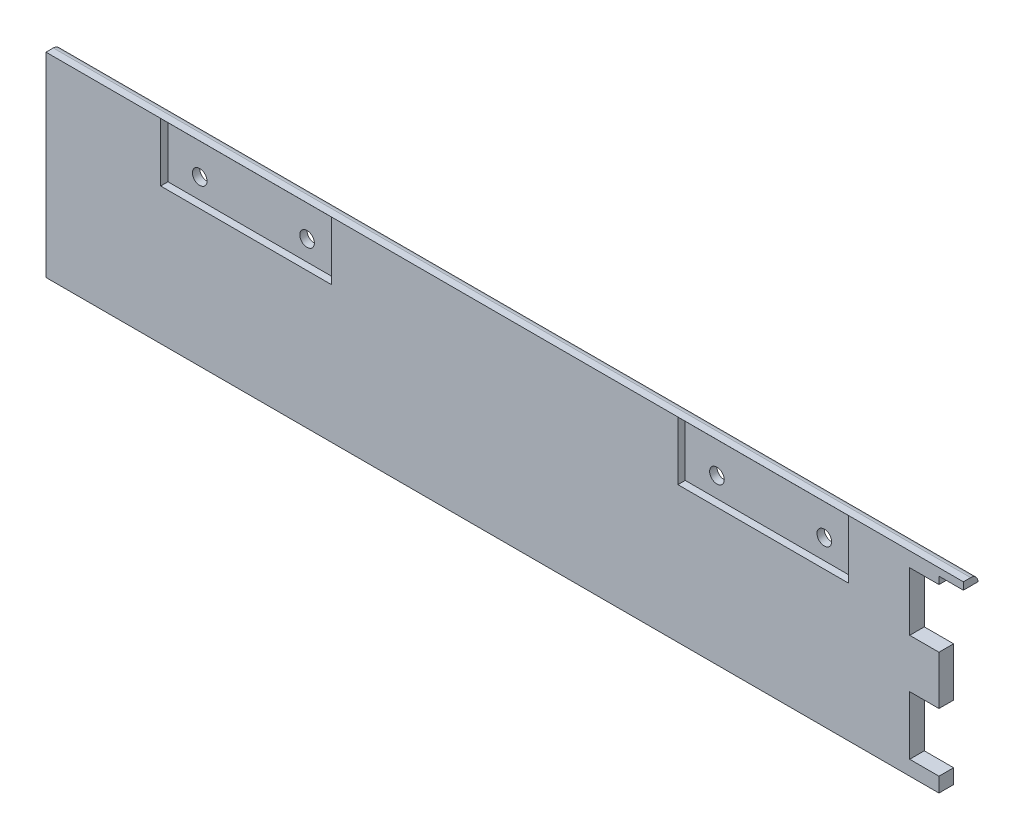
from build123d import *

# Parameters (mm, degrees)
ESQUISSE1_W             = 188
ESQUISSE1_H             = 40
BOSS_EXTRU_1_DEPTH      = 3
CONG_3_R                = 1.5
ENL_V_MAT_EXTRU_1_DEPTH = 193.231631112
ESQUISSE5_W             = 35
ESQUISSE5_H             = 12
ENL_V_MAT_EXTRU_2_DEPTH = 1.5
ESQUISSE7_R             = 1.5
ENL_V_MAT_EXTRU_3_DEPTH = 1.5
ESQUISSE8_R             = 1.5
ENL_V_MAT_EXTRU_4_DEPTH = 1.5


with BuildPart() as part:
    # Esquisse1 → Boss.-Extru.1 (new body)
    with BuildSketch(Plane.XY):
        with Locations((94, 20)):
            Rectangle(ESQUISSE1_W, ESQUISSE1_H)
    extrude(amount=BOSS_EXTRU_1_DEPTH)

    # Congé3
    cong_3_edges = [part.edges().sort_by_distance(p)[0] for p in [
        (94, 40, 0),
    ]]
    fillet(cong_3_edges, radius=CONG_3_R)

    # Esquisse3 → Enlèv. mat.-Extru.1 (cut, through all)
    with BuildSketch(Plane(origin=(0, 0, 0), x_dir=(-1, 0, 0), z_dir=(0, 0, -1))):
        Polygon((-177, 37), (-183, 37), (-183, 38.5), (-188, 38.5), (-188, 0), (-183, 0), (-183, 3), (-177, 3), (-177, 15), (-183, 15), (-183, 25), (-177, 25), align=None)
    extrude(amount=-ENL_V_MAT_EXTRU_1_DEPTH, mode=Mode.SUBTRACT)

    # Esquisse5 → Enlèv. mat.-Extru.2 (cut)
    with BuildSketch(Plane.XY.offset(3)):
        with Locations((147, 33.99)):
            Rectangle(ESQUISSE5_W, ESQUISSE5_H)
        with Locations((41, 33.99)):
            Rectangle(ESQUISSE5_W, ESQUISSE5_H)
    extrude(amount=-ENL_V_MAT_EXTRU_2_DEPTH, mode=Mode.SUBTRACT)

    # Esquisse7 → Enlèv. mat.-Extru.3 (cut)
    with BuildSketch(Plane.XY.offset(1.5)):
        with Locations((30, 32.1)):
            Circle(ESQUISSE7_R)
        with Locations((52, 32.1)):
            Circle(ESQUISSE7_R)
    extrude(amount=-ENL_V_MAT_EXTRU_3_DEPTH, mode=Mode.SUBTRACT)

    # Esquisse8 → Enlèv. mat.-Extru.4 (cut)
    with BuildSketch(Plane.XY.offset(1.5)):
        with Locations((136, 32.1)):
            Circle(ESQUISSE8_R)
        with Locations((158, 32.1)):
            Circle(ESQUISSE8_R)
    extrude(amount=-ENL_V_MAT_EXTRU_4_DEPTH, mode=Mode.SUBTRACT)


solid = part.part
